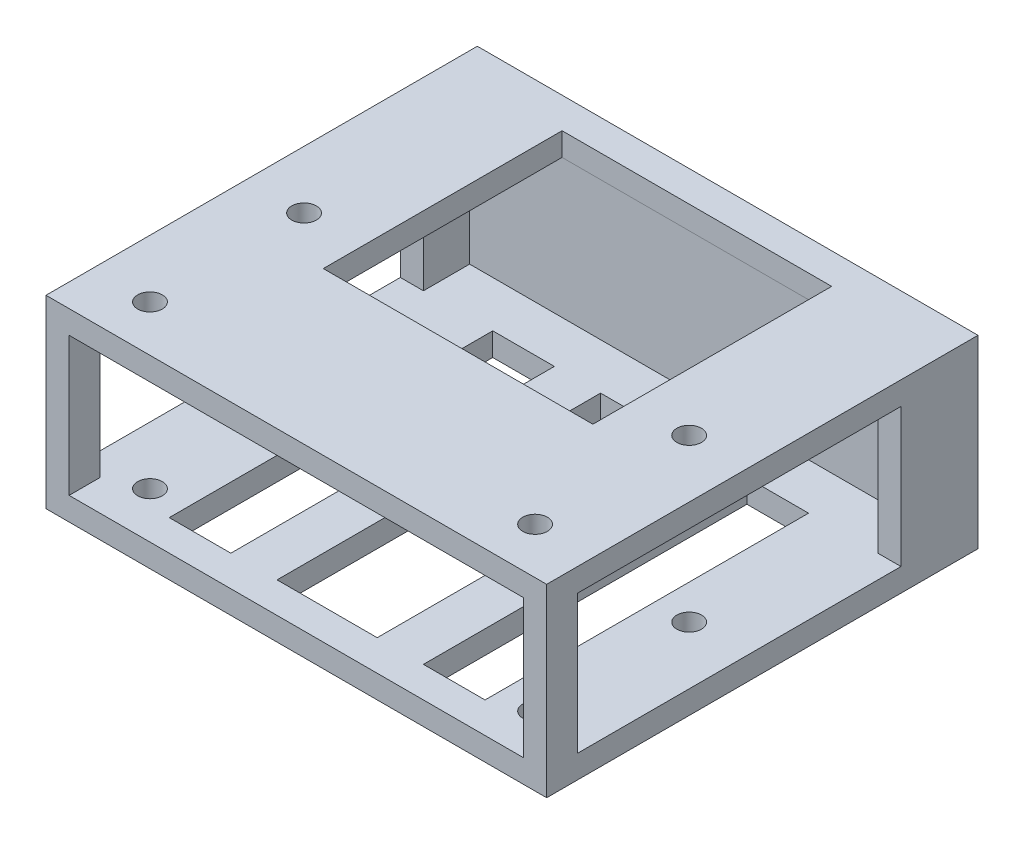
from build123d import *

# Parameters (mm, degrees)
SKETCH_1_W          = 59
SKETCH_1_H          = 18
EXTRUDE_1_DEPTH     = 4
SKETCH_2_W          = 65
SKETCH_2_H          = 24
SKETCH_2_W_2        = 59
SKETCH_2_H_2        = 18
EXTRUDE_3_DEPTH     = 56
SKETCH_3_W          = 35
SKETCH_3_H          = 31
CUT_EXTRUDE_1_DEPTH = 3
SKETCH_4_R          = 1.6
CUT_EXTRUDE_2_DEPTH = 70.052516247
SKETCH_5_W          = 42
SKETCH_5_H          = 18
CUT_EXTRUDE_3_DEPTH = 87.631403082
SKETCH_6_W          = 13
SKETCH_6_H          = 42
SKETCH_6_W_2        = 8
CUT_EXTRUDE_4_DEPTH = 3


with BuildPart() as part:
    # 草图1 → 凸台-拉伸1 (new body)
    with BuildSketch(Plane.XY):
        Rectangle(SKETCH_1_W, SKETCH_1_H)
    extrude(amount=EXTRUDE_1_DEPTH)


with BuildPart() as body_2:
    # 草图2 → 凸台-拉伸3 (new body)
    with BuildSketch(Plane(origin=(0, 0, 0), x_dir=(-1, 0, 0), z_dir=(0, 0, -1))):
        Rectangle(SKETCH_2_W, SKETCH_2_H)
        Rectangle(SKETCH_2_W_2, SKETCH_2_H_2, mode=Mode.SUBTRACT)
    extrude(amount=-EXTRUDE_3_DEPTH)

    # 草图3 → 切除-拉伸1 (cut)
    with BuildSketch(Plane(origin=(0, 12, 0), x_dir=(1, 0, 0), z_dir=(0, 1, 0))):
        with Locations((0, -19.5)):
            Rectangle(SKETCH_3_W, SKETCH_3_H)
    extrude(amount=-CUT_EXTRUDE_1_DEPTH, mode=Mode.SUBTRACT)

    # 草图4 → 切除-拉伸2 (cut, through all)
    with BuildSketch(Plane.XZ.offset(12)):
        with Locations(Location((25, 50, 0), (0, 0, 270))):
            Circle(SKETCH_4_R)
        with Locations(Location((25, 30, 0), (0, 0, 270))):
            Circle(SKETCH_4_R)
        with Locations(Location((-25, 30, 0), (0, 0, 270))):
            Circle(SKETCH_4_R)
        with Locations(Location((-25, 50, 0), (0, 0, 270))):
            Circle(SKETCH_4_R)
    extrude(amount=-CUT_EXTRUDE_2_DEPTH, mode=Mode.SUBTRACT)

    # 草图5 → 切除-拉伸3 (cut, through all)
    with BuildSketch(Plane(origin=(32.5, 0, 0), x_dir=(0, 0, -1), z_dir=(1, 0, 0))):
        with Locations((-31, 0)):
            Rectangle(SKETCH_5_W, SKETCH_5_H)
    extrude(amount=-CUT_EXTRUDE_3_DEPTH, mode=Mode.SUBTRACT)

    # 草图6 → 切除-拉伸4 (cut)
    with BuildSketch(Plane.XZ.offset(12)):
        with Locations((0, 31)):
            Rectangle(SKETCH_6_W, SKETCH_6_H)
        with Locations((16.5, 31)):
            Rectangle(SKETCH_6_W_2, SKETCH_6_H)
        with Locations((-16.5, 31)):
            Rectangle(SKETCH_6_W_2, SKETCH_6_H)
    extrude(amount=-CUT_EXTRUDE_4_DEPTH, mode=Mode.SUBTRACT)


solid = Compound([part.part, body_2.part])
